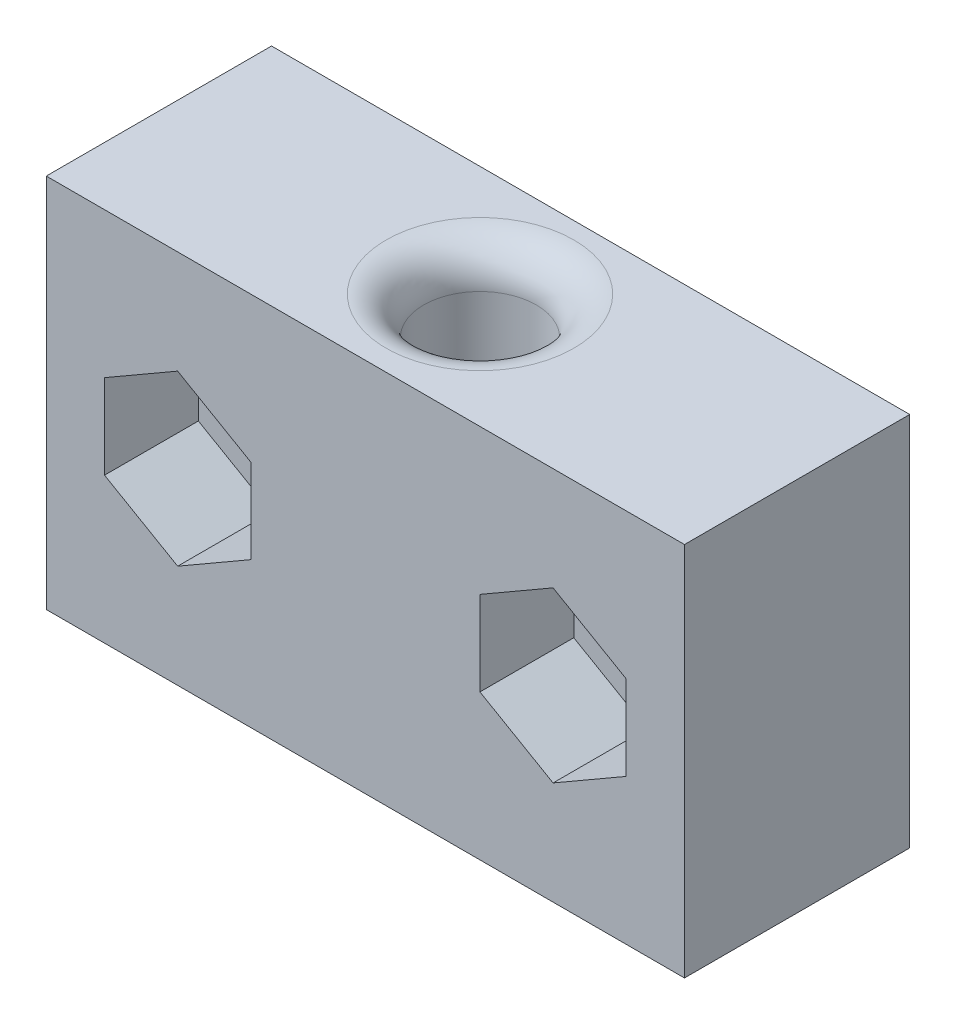
from build123d import *

# Parameters (mm, degrees)
SKETCH1_W           = 34
SKETCH1_H           = 20
BOSS_EXTRUDE1_DEPTH = 12
SKETCH2_R           = 2.5
CUT_EXTRUDE5_DEPTH  = 12
SKETCH2_8_R         = 4.3
SKETCH2_8_R_2       = 2.5
CUT_EXTRUDE6_DEPTH  = 2
SKETCH6_R           = 3
CUT_EXTRUDE7_DEPTH  = 20
FILLET1_R           = 2
CUT_EXTRUDE8_DEPTH  = 5


with BuildPart() as part:
    # Sketch1 → Boss-Extrude1 (new body)
    with BuildSketch(Plane.XY):
        Rectangle(SKETCH1_W, SKETCH1_H)
    extrude(amount=BOSS_EXTRUDE1_DEPTH)

    # Sketch2 → Cut-Extrude5 (cut)
    with BuildSketch(Plane(origin=(0, 0, 0), x_dir=(-1, 0, 0), z_dir=(0, 0, -1))):
        with Locations((10, 0)):
            Circle(SKETCH2_R)
        with Locations((-10, 0)):
            Circle(SKETCH2_R)
    extrude(amount=-CUT_EXTRUDE5_DEPTH, mode=Mode.SUBTRACT)

    # Sketch2<8> → Cut-Extrude6 (cut)
    # profile 1 of 2: a face of its own
    with BuildSketch(Plane(origin=(0, 0, 0), x_dir=(-1, 0, 0), z_dir=(0, 0, -1))):
        with Locations((10, 0)):
            Circle(SKETCH2_8_R)
        with Locations((10, 0)):
            Circle(SKETCH2_8_R_2, mode=Mode.SUBTRACT)
    # profile 2 of 2: a face of its own
    with BuildSketch(Plane(origin=(0, 0, 0), x_dir=(-1, 0, 0), z_dir=(0, 0, -1))):
        with Locations((-10, 0)):
            Circle(SKETCH2_8_R)
        with Locations((-10, 0)):
            Circle(SKETCH2_8_R_2, mode=Mode.SUBTRACT)
    extrude(amount=-CUT_EXTRUDE6_DEPTH, mode=Mode.SUBTRACT)

    # Sketch6 → Cut-Extrude7 (cut)
    with BuildSketch(Plane(origin=(0, 10, 0), x_dir=(1, 0, 0), z_dir=(0, 1, 0))):
        with Locations(Location((0, -5.892499296, 0), (0, 0, 270))):
            Circle(SKETCH6_R)
    extrude(amount=-CUT_EXTRUDE7_DEPTH, mode=Mode.SUBTRACT)

    # Fillet1
    fillet1_edges = [part.edges().sort_by_distance(p)[0] for p in [
        (0, 10, 2.892499296),
        (0, -10, 2.892499296),
    ]]
    fillet(fillet1_edges, radius=FILLET1_R)

    # Sketch7 → Cut-Extrude8 (cut)
    with BuildSketch(Plane.XY.offset(12)):
        Polygon((-10, 4.5), (-13.897114317, 2.25), (-13.897114317, -2.25), (-10, -4.5), (-6.102885683, -2.25), (-6.102885683, 2.25), align=None)
        Polygon((10, 4.5), (6.102885683, 2.25), (6.102885683, -2.25), (10, -4.5), (13.897114317, -2.25), (13.897114317, 2.25), align=None)
    extrude(amount=-CUT_EXTRUDE8_DEPTH, mode=Mode.SUBTRACT)


solid = part.part
